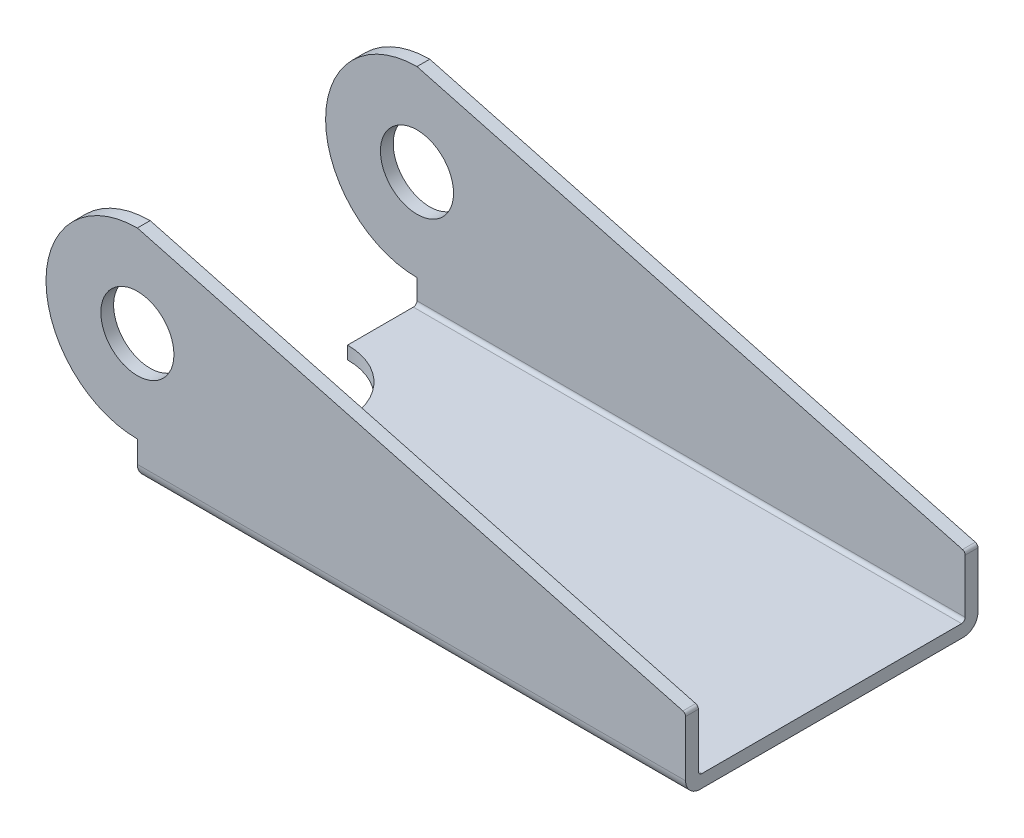
from build123d import *

# Parameters (mm, degrees)
EXTRUDED_BOSS_FRONT_PLANE_WING_DEPTH      = 10.16
EXTRUDED_BOSS_FRONT_PLANE_WING_DEPTH_BACK = 10.16
EXTRUDED_CUT_RIGHT_PLANE_WING_DEPTH       = 32.315223135
EXTRUDED_CUT_RIGHT_PLANE_WING_DEPTH_BACK  = 32.315223135
SKETCH3_W                                 = 18.542
SKETCH3_H                                 = 14.351
F_2X_0_2D_HOLES_D                         = 5.08
F_0_35D_HOLE_D                            = 8.89
INNER_CONNECTING_FILLET_R                 = 0.254
OUTTER_CONNECTING_FILLET_R                = 1.016


with BuildPart() as part:
    # Sketch2 → Extruded Boss Front Plane Wing (new, two sides: drawn at the far end of the back side and taken through both)
    with BuildSketch(Plane.XY.offset(-EXTRUDED_BOSS_FRONT_PLANE_WING_DEPTH_BACK)):
        with BuildLine():
            Line((-19.05, 0), (19.05, 0))
            Line((19.05, 0), (19.05, 5.08))
            Line((19.05, 5.08), (-19.05, 15.24))
            ThreePointArc((-19.05, 15.24), (-25.4, 8.89), (-19.05, 2.54))
            Line((-19.05, 2.54), (-19.05, 0))
        make_face()
    extrude(amount=EXTRUDED_BOSS_FRONT_PLANE_WING_DEPTH + EXTRUDED_BOSS_FRONT_PLANE_WING_DEPTH_BACK)

    # Sketch3 → Extruded Cut Right Plane Wing (cut, two sides: drawn at the far end of the back side and taken through both)
    with BuildSketch(Plane(origin=(0, 0, 0), x_dir=(0, 0, -1), z_dir=(1, 0, 0)).offset(-EXTRUDED_CUT_RIGHT_PLANE_WING_DEPTH_BACK)):
        with Locations((0, 8.0645)):
            Rectangle(SKETCH3_W, SKETCH3_H)
    extrude(amount=EXTRUDED_CUT_RIGHT_PLANE_WING_DEPTH + EXTRUDED_CUT_RIGHT_PLANE_WING_DEPTH_BACK, mode=Mode.SUBTRACT)

    # 2X 0.2D Holes (through all)
    with Locations(Plane.XY.offset(10.16)):
        with Locations((-19.05, 8.89)):
            Hole(F_2X_0_2D_HOLES_D / 2)

    # 0.35D Hole (through all)
    with Locations(Plane(origin=(0, 0.889, 0), x_dir=(1, 0, 0), z_dir=(0, 1, 0))):
        with Locations((-19.05, 0)):
            Hole(F_0_35D_HOLE_D / 2)

    # Inner Connecting Fillet
    inner_connecting_fillet_edges = [part.edges().sort_by_distance(p)[0] for p in [
        (0, 0.889, 9.271),
        (0, 0.889, -9.271),
        (19.05, 5.08, -9.7155),
        (19.05, 5.08, 9.7155),
    ]]
    fillet(inner_connecting_fillet_edges, radius=INNER_CONNECTING_FILLET_R)

    # Outter Connecting Fillet
    outter_connecting_fillet_edges = [part.edges().sort_by_distance(p)[0] for p in [
        (0, 0, -10.16),
        (0, 0, 10.16),
    ]]
    fillet(outter_connecting_fillet_edges, radius=OUTTER_CONNECTING_FILLET_R)


solid = part.part
